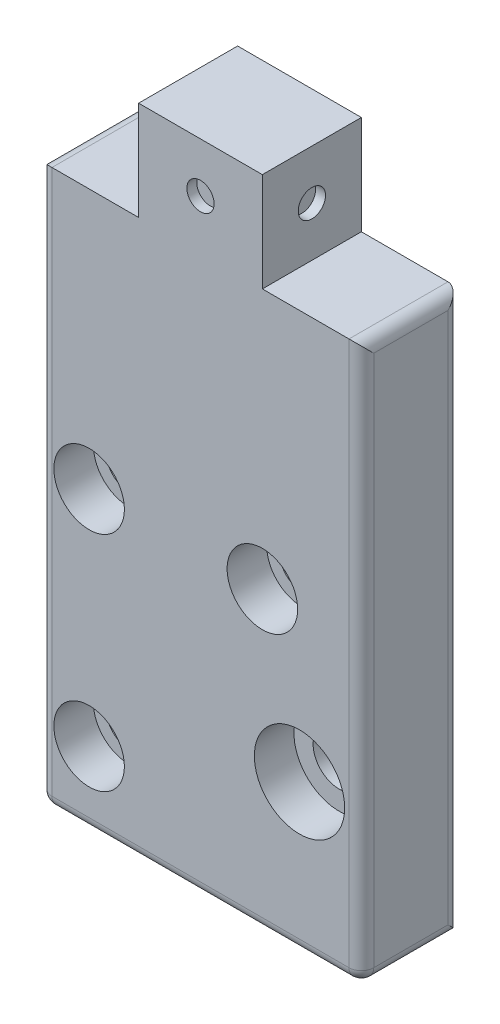
from build123d import *

# Parameters (mm, degrees)
SKETCH1_R           = 2.286
SKETCH1_R_2         = 2.667
BOSS_EXTRUDE1_DEPTH = 10.16
SKETCH7_R           = 3.6195
SKETCH7_R_2         = 4.6355
CUT_EXTRUDE1_DEPTH  = 4.064
SKETCH3_R           = 1.397
CUT_EXTRUDE2_DEPTH  = 1.016
SKETCH8_R           = 1.397
CUT_EXTRUDE3_DEPTH  = 1.016
CUT_EXTRUDE4_START  = -1.016
SKETCH9_R           = 1.397
CUT_EXTRUDE4_DEPTH  = 1.016
FILLET1_R           = 1.27


with BuildPart() as part:
    # Sketch1 → Boss-Extrude1 (new body)
    with BuildSketch(Plane.XY):
        Polygon((0, 57.15), (10.16, 57.15), (10.16, 67.31), (22.86, 67.31), (22.86, 57.15), (33.02, 57.15), (33.02, 0), (0, 0), align=None)
        with Locations((5.08, 7.62)):
            Circle(SKETCH1_R, mode=Mode.SUBTRACT)
        with Locations((5.08, 30.48)):
            Circle(SKETCH1_R, mode=Mode.SUBTRACT)
        with Locations((26.67, 15.24)):
            Circle(SKETCH1_R_2, mode=Mode.SUBTRACT)
        with Locations((22.86, 30.48)):
            Circle(SKETCH1_R, mode=Mode.SUBTRACT)
    extrude(amount=BOSS_EXTRUDE1_DEPTH)

    # Sketch7 → Cut-Extrude1 (cut)
    with BuildSketch(Plane.XY.offset(10.16)):
        with Locations((5.08, 30.48)):
            Circle(SKETCH7_R)
        with Locations((22.86, 30.48)):
            Circle(SKETCH7_R)
        with Locations((5.08, 7.62)):
            Circle(SKETCH7_R)
        with Locations((26.67, 15.24)):
            Circle(SKETCH7_R_2)
    extrude(amount=-CUT_EXTRUDE1_DEPTH, mode=Mode.SUBTRACT)

    # Sketch3 → Cut-Extrude2 (cut)
    with BuildSketch(Plane(origin=(0, 0, 10.16), x_dir=(-1, 0, 0), z_dir=(0, 0, -1))):
        with Locations((-16.51, 62.23)):
            Circle(SKETCH3_R)
    extrude(amount=CUT_EXTRUDE2_DEPTH, mode=Mode.SUBTRACT)

    # Sketch8 → Cut-Extrude3 (cut)
    with BuildSketch(Plane(origin=(22.86, 0, 0), x_dir=(0, 0, -1), z_dir=(1, 0, 0))):
        with Locations((-5.08, 62.23)):
            Circle(SKETCH8_R)
    extrude(amount=-CUT_EXTRUDE3_DEPTH, mode=Mode.SUBTRACT)

    # Sketch9 → Cut-Extrude4 (cut)
    with BuildSketch(Plane.ZY.offset(-10.16).offset(CUT_EXTRUDE4_START)):
        with Locations(Location((5.08, 62.23, 0), (0, 0, 180))):
            Circle(SKETCH9_R)
    extrude(amount=CUT_EXTRUDE4_DEPTH, mode=Mode.SUBTRACT)

    # Fillet1
    fillet1_edges = [part.edges().sort_by_distance(p)[0] for p in [
        (33.02, 28.575, 10.16),
        (0, 57.15, 5.08),
        (33.02, 57.15, 5.08),
        (33.02, 0, 5.08),
        (0, 0, 5.08),
        (0, 28.575, 10.16),
        (16.51, 0, 10.16),
        (33.02, 28.575, 0),
    ]]
    fillet(fillet1_edges, radius=FILLET1_R)


solid = part.part
